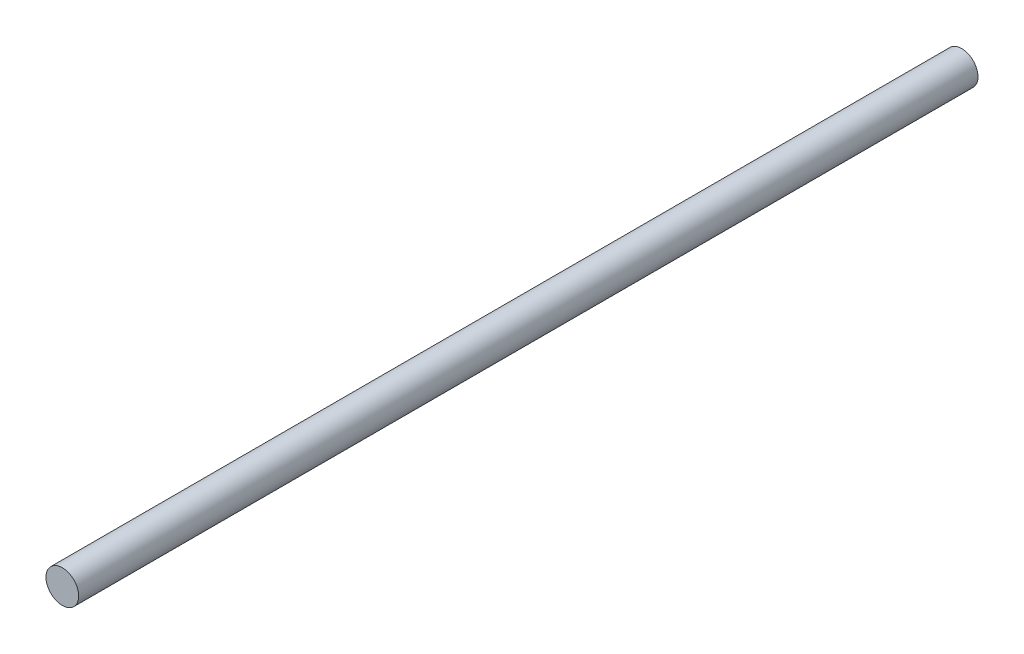
from build123d import *

# Parameters (mm, degrees)
ESQUISSE1_R        = 4
BOSS_EXTRU_1_DEPTH = 220


with BuildPart() as part:
    # Esquisse1 → Boss.-Extru.1 (new body)
    with BuildSketch(Plane.XY):
        Circle(ESQUISSE1_R)
    extrude(amount=BOSS_EXTRU_1_DEPTH)


solid = part.part
